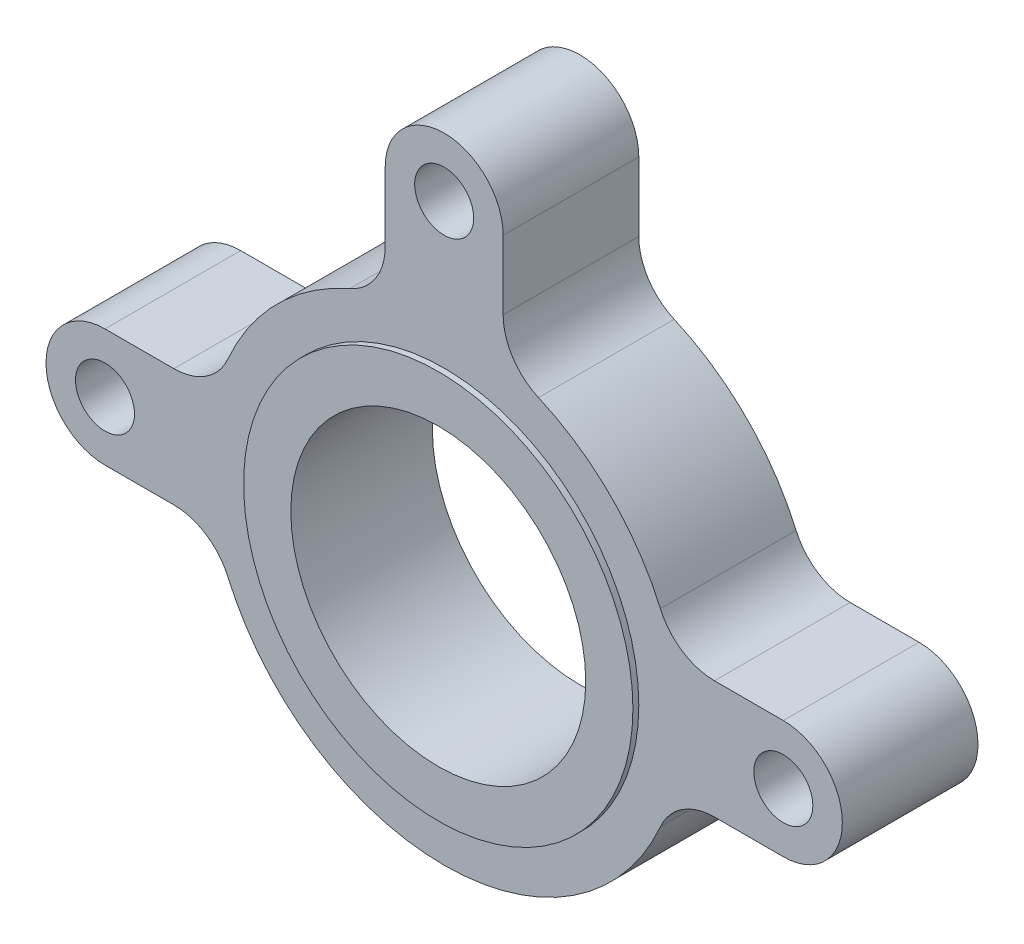
from build123d import *

# Parameters (mm, degrees)
IZIM1_R                     = 2.5
IZIM1_R_2                   = 16.5
Y_KSEKLIK_EKSTR_ZYON2_DEPTH = 11.5
IZIM1_4_R                   = 16.5
IZIM1_4_R_2                 = 12.5
Y_KSEKLIK_EKSTR_ZYON4_DEPTH = 12


with BuildPart() as part:
    # Çizim1 → Yükseklik-Ekstrüzyon2 (new body)
    with BuildSketch(Plane.XY):
        with BuildLine():
            Line((5, 22.912878475), (5, 28.75))
            ThreePointArc((5, 28.75), (0, 33.75), (-5, 28.75))
            Line((-5, 28.75), (-5, 22.912878475))
            ThreePointArc((-5, 22.912878475), (-5.816699867, 20.174265687), (-8, 18.33030278))
            ThreePointArc((-8, 18.33030278), (-14.142135624, 14.142135624), (-18.33030278, 8))
            ThreePointArc((-18.33030278, 8), (-20.174265687, 5.816699867), (-22.912878475, 5))
            Line((-22.912878475, 5), (-28.75, 5))
            ThreePointArc((-28.75, 5), (-33.75, 0), (-28.75, -5))
            Line((-28.75, -5), (-22.912878475, -5))
            ThreePointArc((-22.912878475, -5), (-20.174265687, -5.816699867), (-18.33030278, -8))
            ThreePointArc((-18.33030278, -8), (-12.975595941, -15.219523973), (-5, -19.364916731))
            ThreePointArc((-5, -19.364916731), (0, -20), (5, -19.364916731))
            ThreePointArc((5, -19.364916731), (12.975595941, -15.219523973), (18.33030278, -8))
            ThreePointArc((18.33030278, -8), (20.174265687, -5.816699867), (22.912878475, -5))
            Line((22.912878475, -5), (28.75, -5))
            ThreePointArc((28.75, -5), (33.75, 0), (28.75, 5))
            Line((28.75, 5), (22.912878475, 5))
            ThreePointArc((22.912878475, 5), (20.174265687, 5.816699867), (18.33030278, 8))
            ThreePointArc((18.33030278, 8), (14.142135624, 14.142135624), (8, 18.33030278))
            ThreePointArc((8, 18.33030278), (5.816699867, 20.174265687), (5, 22.912878475))
        make_face()
        with Locations((-28.75, 0)):
            Circle(IZIM1_R, mode=Mode.SUBTRACT)
        Circle(IZIM1_R_2, mode=Mode.SUBTRACT)
        with Locations((0, 28.75)):
            Circle(IZIM1_R, mode=Mode.SUBTRACT)
        with Locations((28.75, 0)):
            Circle(IZIM1_R, mode=Mode.SUBTRACT)
    extrude(amount=Y_KSEKLIK_EKSTR_ZYON2_DEPTH)

    # Çizim1<4> → Yükseklik-Ekstrüzyon4 (add)
    with BuildSketch(Plane.XY):
        Circle(IZIM1_4_R)
        Circle(IZIM1_4_R_2, mode=Mode.SUBTRACT)
    extrude(amount=Y_KSEKLIK_EKSTR_ZYON4_DEPTH)


solid = part.part
